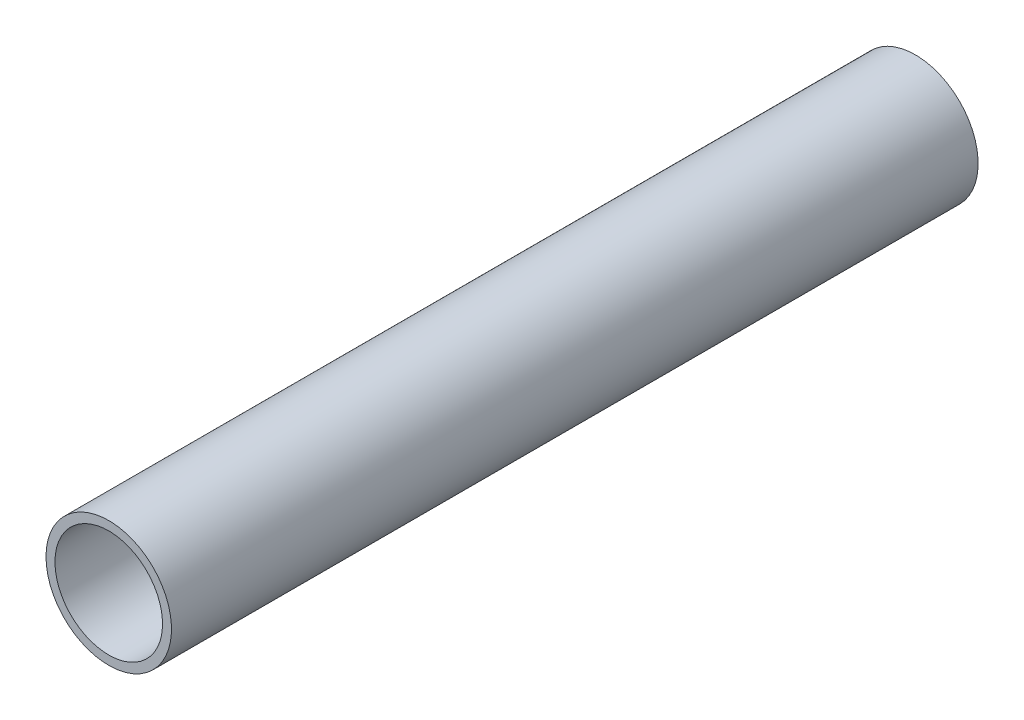
from build123d import *

# Parameters (mm, degrees)
SKETCH_1_R      = 7
SKETCH_1_R_2    = 6
EXTRUDE_1_DEPTH = 90


with BuildPart() as part:
    # 스케치1 → 보스-돌출1 (new body)
    with BuildSketch(Plane.XY):
        with Locations(Location((0, 0, 0), (0, 0, 180))):
            Circle(SKETCH_1_R)
        with Locations(Location((0, 0, 0), (0, 0, 180))):
            Circle(SKETCH_1_R_2, mode=Mode.SUBTRACT)
    extrude(amount=EXTRUDE_1_DEPTH)


solid = part.part
